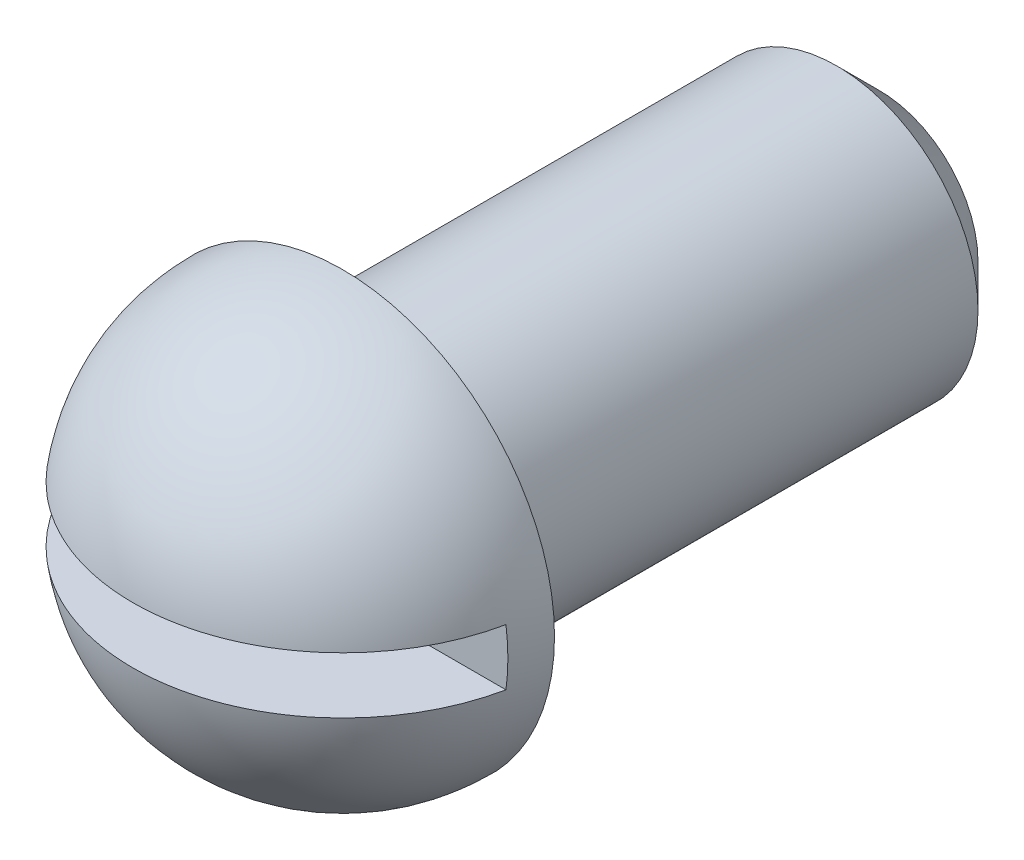
from build123d import *

# Parameters (mm, degrees)
CUT_EXTRUDE1_DEPTH      = 41.074929819
CUT_EXTRUDE1_DEPTH_BACK = 41.074929819
SKETCH2_W               = 24
SKETCH2_H               = 4
CHAMFER1_SIZE           = 3


with BuildPart() as part:
    # Sketch1 → Revolve1 (revolve)
    with BuildSketch(Plane(origin=(0, 0, 0), x_dir=(0, 0, -1), z_dir=(1, 0, 0)), mode=Mode.PRIVATE) as revolve1_sk:
        with BuildLine():
            Line((-19, 10), (-19, 15))
            ThreePointArc((-19, 15), (-29.606601718, 10.606601718), (-34, 0))
            Line((-34, 0), (19, 0))
            Line((19, 0), (19, 10))
            Line((19, 10), (-19, 10))
        make_face()
    revolve(revolve1_sk.sketch.rotate(Axis((0, 0, 27.28531856), (0, 0, -1)), 90), axis=Axis((0, 0, 27.28531856), (0, 0, -1)))

    # Sketch2 → Cut-Extrude1 (cut, two sides: drawn at the far end of the back side and taken through both)
    with BuildSketch(Plane(origin=(0, 0, 0), x_dir=(0, 0, -1), z_dir=(1, 0, 0)).offset(-CUT_EXTRUDE1_DEPTH_BACK)):
        with Locations((-34, 0)):
            Rectangle(SKETCH2_W, SKETCH2_H)
    extrude(amount=CUT_EXTRUDE1_DEPTH + CUT_EXTRUDE1_DEPTH_BACK, mode=Mode.SUBTRACT)

    # Chamfer1
    chamfer1_edges = [part.edges().sort_by_distance(p)[0] for p in [
        (-10, 0, -19),
    ]]
    chamfer(chamfer1_edges, length=CHAMFER1_SIZE)


solid = part.part
